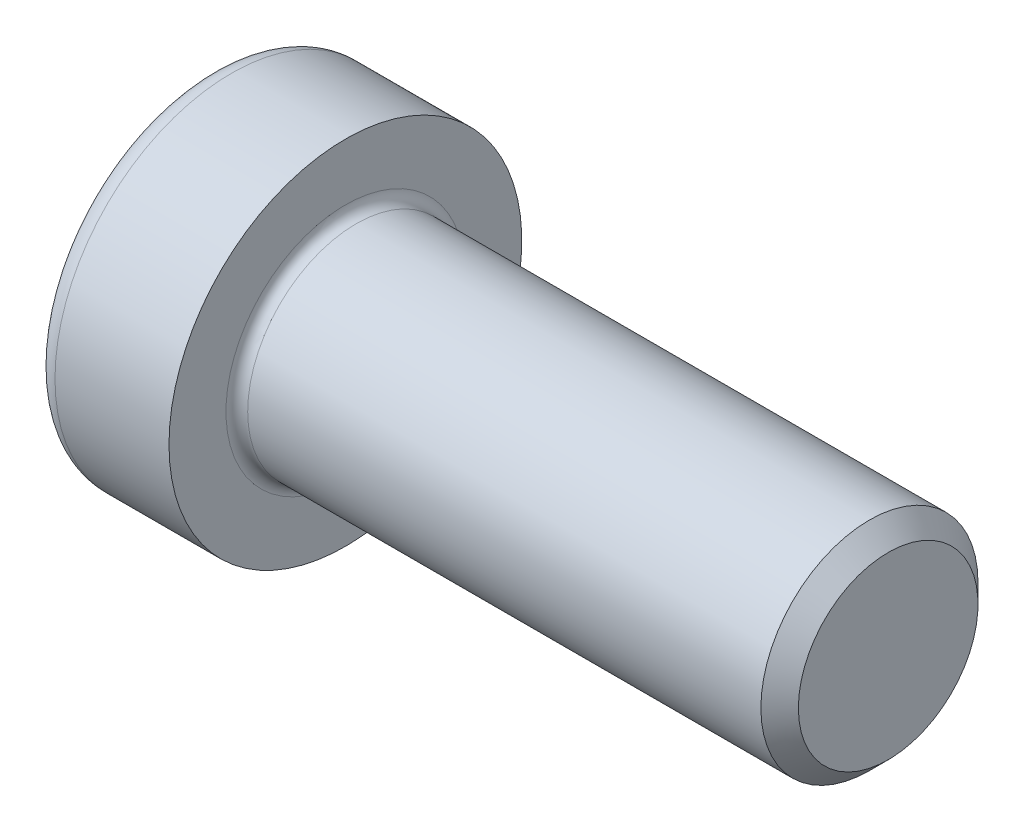
from build123d import *

# Parameters (mm, degrees)
FILLET1_R   = 0.4
FILLET2_R   = 0.8
HEX_2_DEPTH = 3.8


with BuildPart() as part:
    # BodySke → Base-Revolve (revolve)
    with BuildSketch(Plane.XY, mode=Mode.PRIVATE) as base_revolve_sk:
        Polygon((0, 0), (0, 6.5), (5, 6.5), (5, 4), (24.3095, 4), (25, 3.3095), (25, 0), align=None)
    revolve(base_revolve_sk.sketch.rotate(Axis((-31.75, 0, 0), (1, 0, 0)), 90), axis=Axis((-31.75, 0, 0), (1, 0, 0)))

    # Fillet1
    fillet1_edges = [part.edges().sort_by_distance(p)[0] for p in [
        (5, 0, -4),
    ]]
    fillet(fillet1_edges, radius=FILLET1_R)

    # Fillet2
    fillet2_edges = [part.edges().sort_by_distance(p)[0] for p in [
        (0, 0, -6.5),
    ]]
    fillet(fillet2_edges, radius=FILLET2_R)

    # Sketch2 → Hex-PreBroach (revolve, cut)
    with BuildSketch(Plane.XY, mode=Mode.PRIVATE) as hex_prebroach_sk:
        Polygon((0, 2.5), (3.8, 2.5), (5.243375673, 0), (0, 0), align=None)
    revolve(hex_prebroach_sk.sketch.rotate(Axis((0, 0, 0), (1, 0, 0)), 90), axis=Axis((0, 0, 0), (1, 0, 0)), mode=Mode.SUBTRACT)

    # Sketch3 → Hex 2 (cut)
    with BuildSketch(Plane(origin=(0, 0, 0), x_dir=(0, 0.500000000000001, 0.866025403784438), z_dir=(-1, 0, 0))):
        Polygon((1.443375673, 2.5), (-1.443375673, 2.5), (-2.886751346, 0), (-1.443375673, -2.5), (1.443375673, -2.5), (2.886751346, 0), align=None)
    extrude(amount=-HEX_2_DEPTH, mode=Mode.SUBTRACT)


solid = part.part
